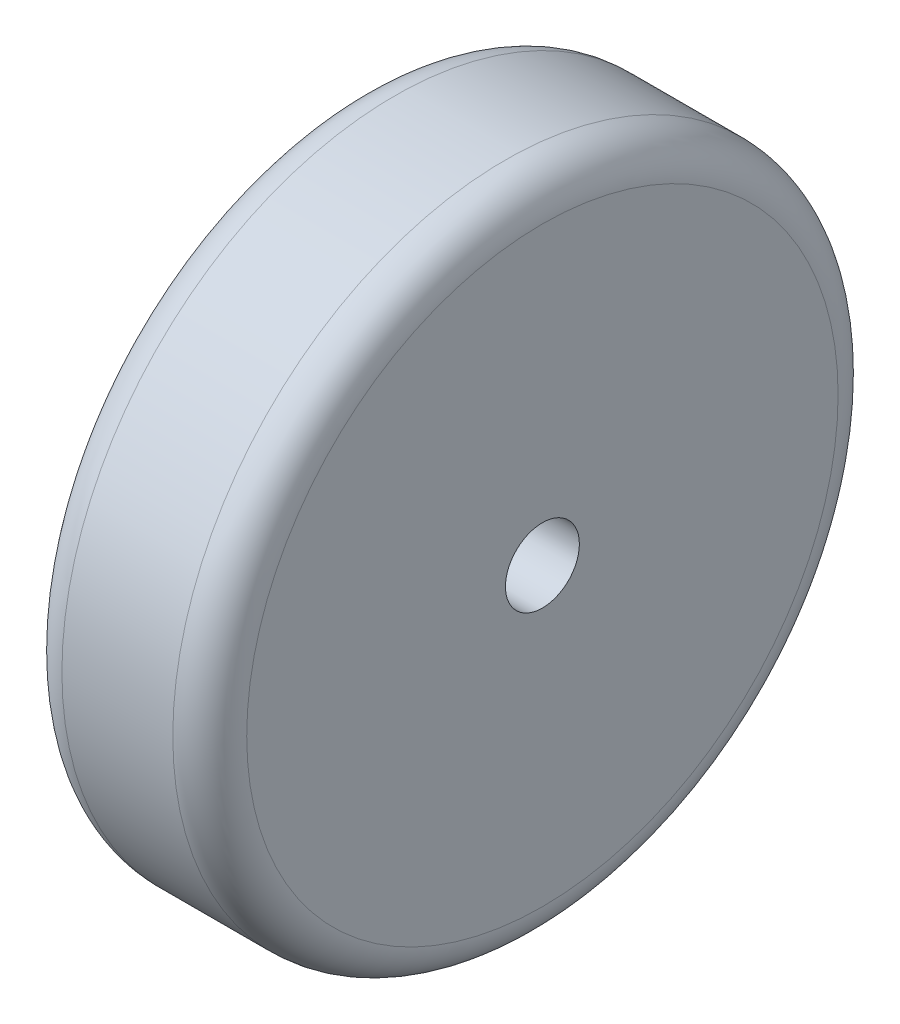
from build123d import *

# Parameters (mm, degrees)
CROQUIS1_R              = 90
CROQUIS1_R_2            = 10
SALIENTE_EXTRUIR1_DEPTH = 25
REDONDEO1_R             = 10


with BuildPart() as part:
    # Croquis1 → Saliente-Extruir1 (new, symmetric)
    with BuildSketch(Plane(origin=(0, 0, 0), x_dir=(0, 0, -1), z_dir=(1, 0, 0))):
        Circle(CROQUIS1_R)
        Circle(CROQUIS1_R_2, mode=Mode.SUBTRACT)
    extrude(amount=SALIENTE_EXTRUIR1_DEPTH, both=True)

    # Redondeo1
    redondeo1_edges = [part.edges().sort_by_distance(p)[0] for p in [
        (-25, 0, 90),
        (25, 0, 90),
    ]]
    fillet(redondeo1_edges, radius=REDONDEO1_R)


solid = part.part
